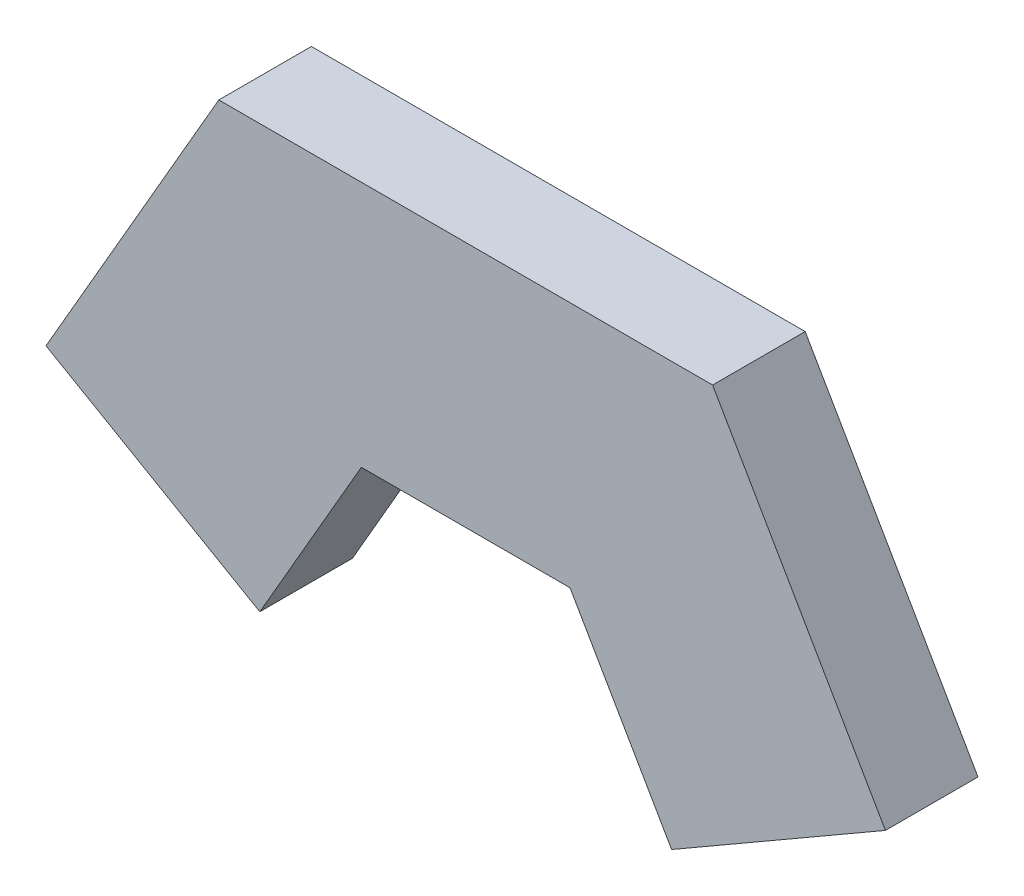
from build123d import *

# Parameters (mm, degrees)
BOSS_EXTRUDE1_DEPTH = 4.7625


with BuildPart() as part:
    # Sketch1 → Boss-Extrude1 (new body)
    with BuildSketch(Plane.XY):
        Polygon((-12.7, 0), (-21.59, -15.397931679), (-10.591477372, -21.747931679), (-5.367651581, -12.7), (5.367651581, -12.7), (10.591477372, -21.747931679), (21.59, -15.397931679), (12.7, 0), (6.35, 0), (-6.35, 0), align=None)
    extrude(amount=BOSS_EXTRUDE1_DEPTH)


solid = part.part
